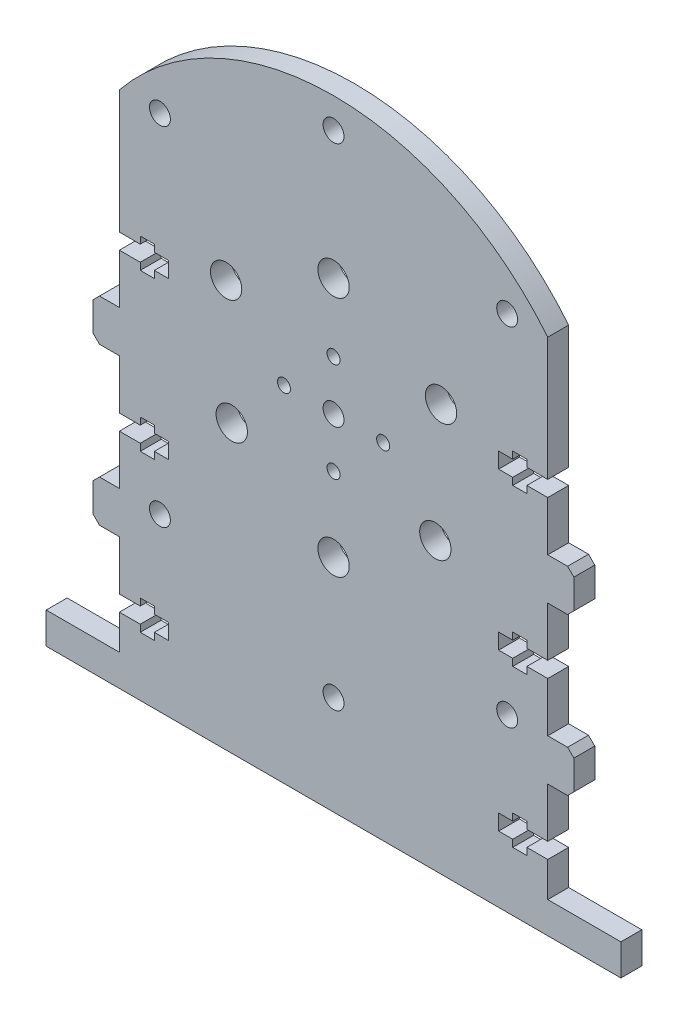
from build123d import *

# Parameters (mm, degrees)
SKETCH_1_R          = 3
SKETCH_1_R_2        = 2
SKETCH_1_R_3        = 1.25
EXTRUDE_2_DEPTH     = 4
SKETCH_4_W          = 110
SKETCH_4_H          = 6
EXTRUDE_3_DEPTH     = 4
CUT_EXTRUDE_1_DEPTH = 4


with BuildPart() as part:
    # 草图1 → 凸台-拉伸2 (new body)
    with BuildSketch(Plane.XY):
        with BuildLine():
            Line((26.037512023, -61.503506411), (-55.962487977, -61.503506411))
            Line((-55.962487977, -61.503506411), (-55.962487977, -54.853506411))
            Line((-55.962487977, -54.853506411), (-51.962487977, -54.853506411))
            Line((-51.962487977, -54.853506411), (-51.962487977, -56.203506411))
            Line((-51.962487977, -56.203506411), (-49.262487977, -56.203506411))
            Line((-49.262487977, -56.203506411), (-49.262487977, -54.853506411))
            Line((-49.262487977, -54.853506411), (-46.562487977, -54.853506411))
            Line((-46.562487977, -54.853506411), (-46.562487977, -51.853506411))
            Line((-46.562487977, -51.853506411), (-49.262487977, -51.853506411))
            Line((-49.262487977, -51.853506411), (-49.262487977, -50.503506411))
            Line((-49.262487977, -50.503506411), (-51.962487977, -50.503506411))
            Line((-51.962487977, -50.503506411), (-51.962487977, -51.853506411))
            Line((-51.962487977, -51.853506411), (-55.962487977, -51.853506411))
            Line((-55.962487977, -51.853506411), (-55.962487977, -42.353506411))
            Line((-55.962487977, -42.353506411), (-60.962487977, -42.353506411))
            Line((-60.962487977, -42.353506411), (-60.962487977, -34.353506411))
            Line((-60.962487977, -34.353506411), (-55.962487977, -34.353506411))
            Line((-55.962487977, -34.353506411), (-55.962487977, -24.853506411))
            Line((-55.962487977, -24.853506411), (-51.962487977, -24.853506411))
            Line((-51.962487977, -24.853506411), (-51.962487977, -26.203506411))
            Line((-51.962487977, -26.203506411), (-49.262487977, -26.203506411))
            Line((-49.262487977, -26.203506411), (-49.262487977, -24.853506411))
            Line((-49.262487977, -24.853506411), (-46.562487977, -24.853506411))
            Line((-46.562487977, -24.853506411), (-46.562487977, -21.853506411))
            Line((-46.562487977, -21.853506411), (-49.262487977, -21.853506411))
            Line((-49.262487977, -21.853506411), (-49.262487977, -20.503506411))
            Line((-49.262487977, -20.503506411), (-51.962487977, -20.503506411))
            Line((-51.962487977, -20.503506411), (-51.962487977, -21.853506411))
            Line((-51.962487977, -21.853506411), (-55.962487977, -21.853506411))
            Line((-55.962487977, -21.853506411), (-55.962487977, -12.353506411))
            Line((-55.962487977, -12.353506411), (-60.962487977, -12.353506411))
            Line((-60.962487977, -12.353506411), (-60.962487977, -4.353506411))
            Line((-60.962487977, -4.353506411), (-55.962487977, -4.353506411))
            Line((-55.962487977, -4.353506411), (-55.962487977, 5.146493589))
            Line((-55.962487977, 5.146493589), (-51.962487977, 5.146493589))
            Line((-51.962487977, 5.146493589), (-51.962487977, 3.796493589))
            Line((-51.962487977, 3.796493589), (-49.262487977, 3.796493589))
            Line((-49.262487977, 3.796493589), (-49.262487977, 5.146493589))
            Line((-49.262487977, 5.146493589), (-46.562487977, 5.146493589))
            Line((-46.562487977, 5.146493589), (-46.562487977, 8.146493589))
            Line((-46.562487977, 8.146493589), (-49.262487977, 8.146493589))
            Line((-49.262487977, 8.146493589), (-49.262487977, 9.496493589))
            Line((-49.262487977, 9.496493589), (-51.962487977, 9.496493589))
            Line((-51.962487977, 9.496493589), (-51.962487977, 8.146493589))
            Line((-51.962487977, 8.146493589), (-55.962487977, 8.146493589))
            Line((-55.962487977, 8.146493589), (-55.962487977, 23.496493589))
            Line((-55.962487977, 23.496493589), (-55.962487977, 31.722989041))
            ThreePointArc((-55.962487977, 31.722989041), (-14.962487977, 51.269592797), (26.037512023, 31.722989041))
            Line((26.037512023, 31.722989041), (26.037512023, 23.496493589))
            Line((26.037512023, 23.496493589), (26.037512023, 8.146493589))
            Line((26.037512023, 8.146493589), (22.037512023, 8.146493589))
            Line((22.037512023, 8.146493589), (22.037512023, 9.496493589))
            Line((22.037512023, 9.496493589), (19.337512023, 9.496493589))
            Line((19.337512023, 9.496493589), (19.337512023, 8.146493589))
            Line((19.337512023, 8.146493589), (16.637512023, 8.146493589))
            Line((16.637512023, 8.146493589), (16.637512023, 5.146493589))
            Line((16.637512023, 5.146493589), (19.337512023, 5.146493589))
            Line((19.337512023, 5.146493589), (19.337512023, 3.796493589))
            Line((19.337512023, 3.796493589), (22.037512023, 3.796493589))
            Line((22.037512023, 3.796493589), (22.037512023, 5.146493589))
            Line((22.037512023, 5.146493589), (26.037512023, 5.146493589))
            Line((26.037512023, 5.146493589), (26.037512023, -4.353506411))
            Line((26.037512023, -4.353506411), (31.037512023, -4.353506411))
            Line((31.037512023, -4.353506411), (31.037512023, -12.353506411))
            Line((31.037512023, -12.353506411), (26.037512023, -12.353506411))
            Line((26.037512023, -12.353506411), (26.037512023, -21.853506411))
            Line((26.037512023, -21.853506411), (22.037512023, -21.853506411))
            Line((22.037512023, -21.853506411), (22.037512023, -20.503506411))
            Line((22.037512023, -20.503506411), (19.337512023, -20.503506411))
            Line((19.337512023, -20.503506411), (19.337512023, -21.853506411))
            Line((19.337512023, -21.853506411), (16.637512023, -21.853506411))
            Line((16.637512023, -21.853506411), (16.637512023, -24.853506411))
            Line((16.637512023, -24.853506411), (19.337512023, -24.853506411))
            Line((19.337512023, -24.853506411), (19.337512023, -26.203506411))
            Line((19.337512023, -26.203506411), (22.037512023, -26.203506411))
            Line((22.037512023, -26.203506411), (22.037512023, -24.853506411))
            Line((22.037512023, -24.853506411), (26.037512023, -24.853506411))
            Line((26.037512023, -24.853506411), (26.037512023, -34.353506411))
            Line((26.037512023, -34.353506411), (31.037512023, -34.353506411))
            Line((31.037512023, -34.353506411), (31.037512023, -42.353506411))
            Line((31.037512023, -42.353506411), (26.037512023, -42.353506411))
            Line((26.037512023, -42.353506411), (26.037512023, -51.853506411))
            Line((26.037512023, -51.853506411), (22.037512023, -51.853506411))
            Line((22.037512023, -51.853506411), (22.037512023, -50.503506411))
            Line((22.037512023, -50.503506411), (19.337512023, -50.503506411))
            Line((19.337512023, -50.503506411), (19.337512023, -51.853506411))
            Line((19.337512023, -51.853506411), (16.637512023, -51.853506411))
            Line((16.637512023, -51.853506411), (16.637512023, -54.853506411))
            Line((16.637512023, -54.853506411), (19.337512023, -54.853506411))
            Line((19.337512023, -54.853506411), (19.337512023, -56.203506411))
            Line((19.337512023, -56.203506411), (22.037512023, -56.203506411))
            Line((22.037512023, -56.203506411), (22.037512023, -54.853506411))
            Line((22.037512023, -54.853506411), (26.037512023, -54.853506411))
            Line((26.037512023, -54.853506411), (26.037512023, -61.503506411))
        make_face()
        with Locations((-14.962487977, -25.253506411)):
            Circle(SKETCH_1_R, mode=Mode.SUBTRACT)
        with Locations((4.523083608, -12.753506411)):
            Circle(SKETCH_1_R, mode=Mode.SUBTRACT)
        with Locations((-14.962487977, -1.503506411)):
            Circle(SKETCH_1_R_2, mode=Mode.SUBTRACT)
        with Locations((-35.530591317, 10.371493589)):
            Circle(SKETCH_1_R, mode=Mode.SUBTRACT)
        with Locations((-34.448059562, -12.753506411)):
            Circle(SKETCH_1_R, mode=Mode.SUBTRACT)
        with Locations((5.605615363, 10.371493589)):
            Circle(SKETCH_1_R, mode=Mode.SUBTRACT)
        with Locations((-14.962487977, 20.996493589)):
            Circle(SKETCH_1_R, mode=Mode.SUBTRACT)
        with Locations((18.271530739, -34.737525127)):
            Circle(SKETCH_1_R_2, mode=Mode.SUBTRACT)
        with Locations((-14.962487977, -48.503506411)):
            Circle(SKETCH_1_R_2, mode=Mode.SUBTRACT)
        with Locations((-48.196506692, -34.737525127)):
            Circle(SKETCH_1_R_2, mode=Mode.SUBTRACT)
        with Locations((-48.196506692, 31.730512305)):
            Circle(SKETCH_1_R_2, mode=Mode.SUBTRACT)
        with Locations((-14.962487977, 45.496493589)):
            Circle(SKETCH_1_R_2, mode=Mode.SUBTRACT)
        with Locations((18.271530739, 31.730512305)):
            Circle(SKETCH_1_R_2, mode=Mode.SUBTRACT)
        with Locations((-14.962487977, 7.996493589)):
            Circle(SKETCH_1_R_3, mode=Mode.SUBTRACT)
        with Locations((-5.462487977, -1.503506411)):
            Circle(SKETCH_1_R_3, mode=Mode.SUBTRACT)
        with Locations((-14.962487977, -11.003506411)):
            Circle(SKETCH_1_R_3, mode=Mode.SUBTRACT)
        with Locations((-24.462487977, -1.503506411)):
            Circle(SKETCH_1_R_3, mode=Mode.SUBTRACT)
    extrude(amount=EXTRUDE_2_DEPTH)

    # 草图4 → 凸台-拉伸3 (add)
    with BuildSketch(Plane.XY.offset(4)):
        with Locations((-14.962487977, -64.503506411)):
            Rectangle(SKETCH_4_W, SKETCH_4_H)
    extrude(amount=-EXTRUDE_3_DEPTH)

    # 草图5 → 切除-拉伸1 (cut)
    with BuildSketch(Plane.XY.offset(4)):
        Polygon((-60.962487977, -4.353506411), (-59.762487977, -4.353506411), (-60.962487977, -5.553506411), align=None)
        Polygon((-60.962487977, -12.353506411), (-59.762487977, -12.353506411), (-60.962487977, -11.153506411), align=None)
        Polygon((-60.962487977, -34.353506411), (-59.762487977, -34.353506411), (-60.962487977, -35.553506411), align=None)
        Polygon((-60.962487977, -42.353506411), (-59.762487977, -42.353506411), (-60.962487977, -41.153506411), align=None)
        Polygon((31.037512023, -42.353506411), (31.037512023, -41.153506411), (29.837512023, -42.353506411), align=None)
        Polygon((29.837512023, -34.353506411), (31.037512023, -34.353506411), (31.037512023, -35.553506411), align=None)
        Polygon((31.037512023, -12.353506411), (29.837512023, -12.353506411), (31.037512023, -11.153506411), align=None)
        Polygon((31.037512023, -4.353506411), (29.837512023, -4.353506411), (31.037512023, -5.553506411), align=None)
    extrude(amount=-CUT_EXTRUDE_1_DEPTH, mode=Mode.SUBTRACT)


solid = part.part
